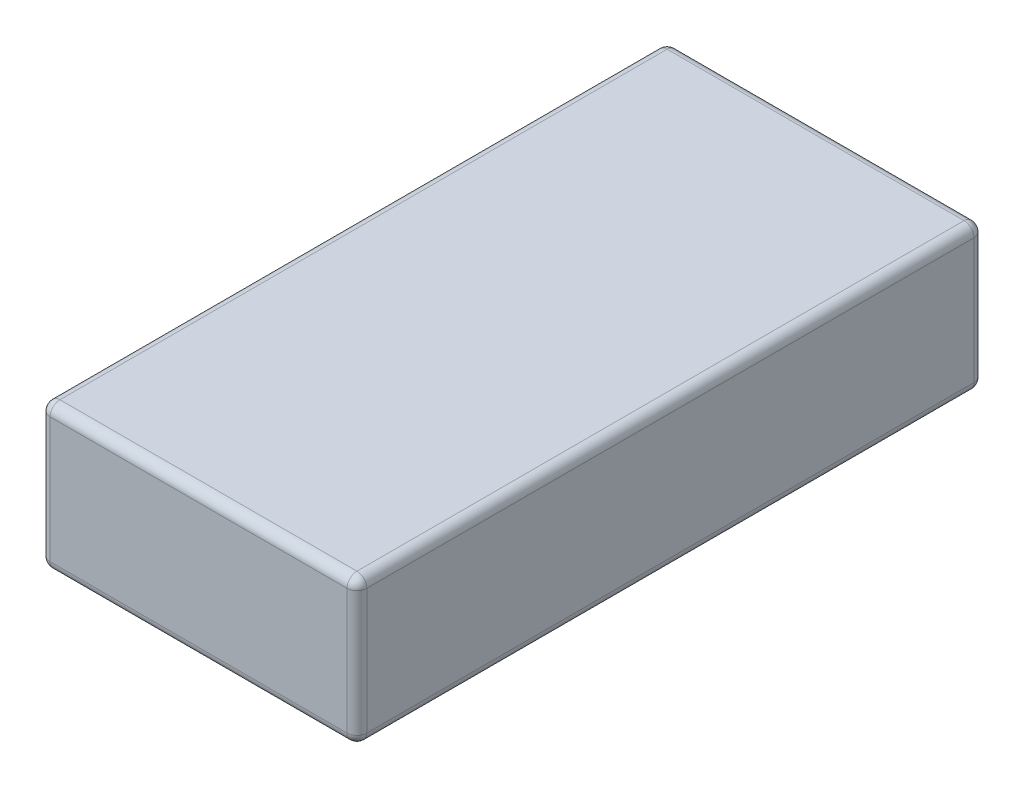
from build123d import *

# Parameters (mm, degrees)
SKETCH_1_W      = 48
SKETCH_1_H      = 22
EXTRUDE_1_DEPTH = 95
FILLET_1_R      = 1.5


with BuildPart() as part:
    # Эскиз1 → Бобышка-Вытянуть1 (new body)
    with BuildSketch(Plane.XY):
        with Locations((24, 11)):
            Rectangle(SKETCH_1_W, SKETCH_1_H)
    extrude(amount=-EXTRUDE_1_DEPTH)

    # Скругление1
    fillet_1_edges = [part.edges().sort_by_distance(p)[0] for p in [
        (48, 11, -95),
        (24, 22, -95),
        (0, 11, -95),
        (24, 22, 0),
        (48, 11, 0),
        (24, 0, 0),
        (0, 11, 0),
        (24, 0, -95),
        (0, 22, -47.5),
        (48, 22, -47.5),
        (48, 0, -47.5),
        (0, 0, -47.5),
    ]]
    fillet(fillet_1_edges, radius=FILLET_1_R)


solid = part.part
